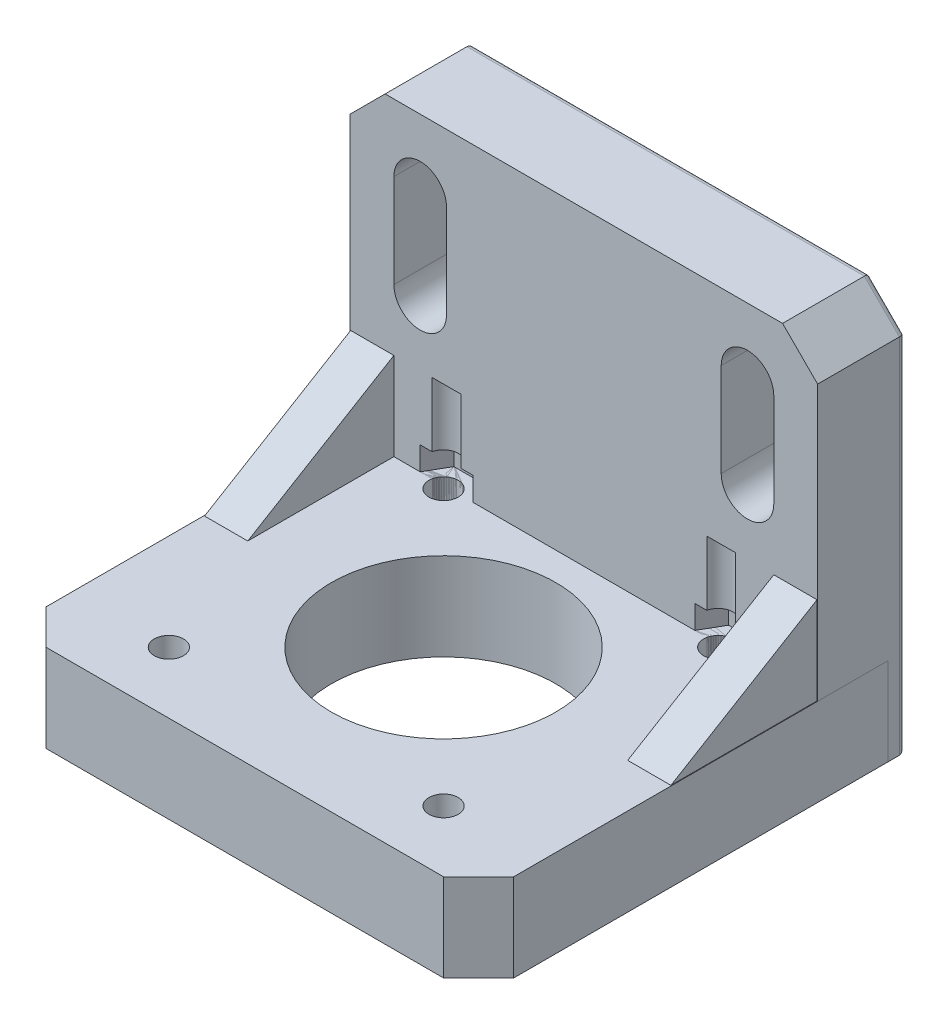
from build123d import *

# Parameters (mm, degrees)
SKETCH1_W               = 80
SKETCH1_H               = 70
BOSS_EXTRUDE1_DEPTH     = 15
SKETCH2_W               = 80
SKETCH2_H               = 3
SKETCH2_H_2             = 12
BOSS_EXTRUDE2_DEPTH     = 68
SKETCH4_R               = 19.2
CUT_EXTRUDE1_DEPTH      = 99.433988033
CUT_EXTRUDE2_DEPTH      = 15
CUT_EXTRUDE2_DEPTH_BACK = 99.433988033
SKETCH5_R               = 2.5
CUT_EXTRUDE3_DEPTH      = 15
BOSS_EXTRUDE3_START     = -0.1
BOSS_EXTRUDE3_DEPTH     = 7.4
BOSS_EXTRUDE4_START     = -0.1
BOSS_EXTRUDE4_DEPTH     = 7.4
CHAMFER1_SIZE           = 6
CUT_EXTRUDE7_START      = 4
SKETCH5_5_R             = 2.5
CUT_EXTRUDE7_DEPTH      = 4
CHAMFER2_SIZE           = 6
FILLET3_R               = 1


with BuildPart() as part:
    # Sketch1 → Boss-Extrude1 (new body)
    with BuildSketch(Plane(origin=(0, 0, 0), x_dir=(1, 0, 0), z_dir=(0, 1, 0))):
        with Locations((7.5, 30)):
            Rectangle(SKETCH1_W, SKETCH1_H)
    extrude(amount=BOSS_EXTRUDE1_DEPTH)

    # Sketch4 → Cut-Extrude1 (cut, through all)
    with BuildSketch(Plane(origin=(0, 15, 0), x_dir=(1, 0, 0), z_dir=(0, 1, 0))):
        with Locations(Location((7.5, 29, 0), (0, 0, 270))):
            Circle(SKETCH4_R)
    extrude(amount=-CUT_EXTRUDE1_DEPTH, mode=Mode.SUBTRACT)


with BuildPart() as body_2:
    # Sketch2 → Boss-Extrude2 (new body)
    with BuildSketch(Plane.XZ):
        with Locations((7.5, -66.5)):
            Rectangle(SKETCH2_W, SKETCH2_H)
        with Locations((7.5, -59)):
            Rectangle(SKETCH2_W, SKETCH2_H_2)
    extrude(amount=-BOSS_EXTRUDE2_DEPTH)


with BuildPart() as cut_extrude2_tool:
    # Sketch5 → Cut-Extrude2 (new, two sides: drawn at the far end of the back side and taken through both)
    with BuildSketch(Plane(origin=(0, 15, 0), x_dir=(1, 0, 0), z_dir=(0, 1, 0)).offset(-CUT_EXTRUDE2_DEPTH_BACK)):
        with Locations(Location((-16, 52.5, 0), (0, 0, 90))):
            Circle(SKETCH5_R)
        with Locations(Location((31, 52.5, 0), (0, 0, 90))):
            Circle(SKETCH5_R)
        with Locations(Location((31, 5.5, 0), (0, 0, 90))):
            Circle(SKETCH5_R)
        with Locations(Location((-16, 5.5, 0), (0, 0, 90))):
            Circle(SKETCH5_R)
    extrude(amount=CUT_EXTRUDE2_DEPTH + CUT_EXTRUDE2_DEPTH_BACK)


with BuildPart() as part_1:
    add(part.part)

    # Cut-Extrude2: cut by cut_extrude2_tool
    add(cut_extrude2_tool.part, mode=Mode.SUBTRACT)

    # Sketch8 → Boss-Extrude3 (add)
    with BuildSketch(Plane.ZY.offset(32.5).offset(BOSS_EXTRUDE3_START)):
        Polygon((-28, 15), (-53, 30), (-53, 15), align=None)
    extrude(amount=-BOSS_EXTRUDE3_DEPTH)

    # Sketch9 → Boss-Extrude4 (add)
    with BuildSketch(Plane(origin=(47.5, 0, 0), x_dir=(0, 0, -1), z_dir=(1, 0, 0)).offset(BOSS_EXTRUDE4_START)):
        Polygon((53, 15), (53, 30), (28, 15), align=None)
    extrude(amount=-BOSS_EXTRUDE4_DEPTH)

    # Chamfer1
    chamfer1_edges = [part_1.edges().sort_by_distance(p)[0] for p in [
        (47.5, 7.5, 5),
        (-32.5, 7.5, 5),
    ]]
    chamfer(chamfer1_edges, length=CHAMFER1_SIZE)


with BuildPart() as body_2_1:
    add(body_2.part)

    # Cut-Extrude2: cut by cut_extrude2_tool
    add(cut_extrude2_tool.part, mode=Mode.SUBTRACT)

    # Sketch6 → Cut-Extrude3 (cut)
    with BuildSketch(Plane.XY.offset(-53)):
        with BuildLine():
            Line((-25, 56.5), (-25, 40.5))
            ThreePointArc((-25, 40.5), (-20.5, 36), (-16, 40.5))
            Line((-16, 40.5), (-16, 56.5))
            ThreePointArc((-16, 56.5), (-20.5, 61), (-25, 56.5))
        make_face()
        with BuildLine():
            ThreePointArc((40, 40.5), (35.5, 36), (31, 40.5))
            Line((31, 40.5), (31, 56.5))
            ThreePointArc((31, 56.5), (35.5, 61), (40, 56.5))
            Line((40, 56.5), (40, 40.5))
        make_face()
    extrude(amount=-CUT_EXTRUDE3_DEPTH, mode=Mode.SUBTRACT)

    # Sketch5<5> → Cut-Extrude7 (cut)
    # profile 1 of 4: a face of its own
    with BuildSketch(Plane(origin=(0, 15, 0), x_dir=(1, 0, 0), z_dir=(0, 1, 0)).offset(CUT_EXTRUDE7_START)):
        Polygon((-18.393996383, 56.65), (-13.601989149, 56.65), (-11.205985531, 52.5), (-13.601989149, 48.35), (-18.393996383, 48.35), (-20.79, 52.5), align=None)
        with Locations(Location((-16, 52.5, 0), (0, 0, 90))):
            Circle(SKETCH5_5_R, mode=Mode.SUBTRACT)
    # profile 2 of 4: a face of its own
    with BuildSketch(Plane(origin=(0, 15, 0), x_dir=(1, 0, 0), z_dir=(0, 1, 0)).offset(CUT_EXTRUDE7_START)):
        Polygon((35.792007234, 52.5), (33.396003617, 48.35), (28.603996383, 48.35), (26.207992766, 52.5), (28.603996383, 56.65), (33.396003617, 56.65), align=None)
        with Locations(Location((31, 52.5, 0), (0, 0, 90))):
            Circle(SKETCH5_5_R, mode=Mode.SUBTRACT)
    # profile 3 of 4: a face of its own
    with BuildSketch(Plane(origin=(0, 15, 0), x_dir=(1, 0, 0), z_dir=(0, 1, 0)).offset(CUT_EXTRUDE7_START)):
        with Locations(Location((31, 52.5, 0), (0, 0, 90))):
            Circle(SKETCH5_5_R)
    # profile 4 of 4: a face of its own
    with BuildSketch(Plane(origin=(0, 15, 0), x_dir=(1, 0, 0), z_dir=(0, 1, 0)).offset(CUT_EXTRUDE7_START)):
        with Locations(Location((-16, 52.5, 0), (0, 0, 90))):
            Circle(SKETCH5_5_R)
    extrude(amount=-CUT_EXTRUDE7_DEPTH, mode=Mode.SUBTRACT)

    # Chamfer2
    chamfer2_edges = [body_2_1.edges().sort_by_distance(p)[0] for p in [
        (-32.5, 68, -60.5),
        (47.5, 68, -60.5),
    ]]
    chamfer(chamfer2_edges, length=CHAMFER2_SIZE)

    # Fillet3
    fillet3_edges = [body_2_1.edges().sort_by_distance(p)[0] for p in [
        (-32.5, 31, -68),
        (7.5, 68, -68),
        (47.5, 31, -68),
        (44.5, 65, -68),
        (-29.5, 65, -68),
        (-16, 48.5, -68),
        (-20.5, 36, -68),
        (-20.5, 61, -68),
        (-25, 48.5, -68),
        (7.5, 0, -68),
        (31, 48.5, -68),
        (40, 48.5, -68),
        (35.5, 36, -68),
        (35.5, 61, -68),
    ]]
    fillet(fillet3_edges, radius=FILLET3_R)


solid = Compound([part_1.part, body_2_1.part])
